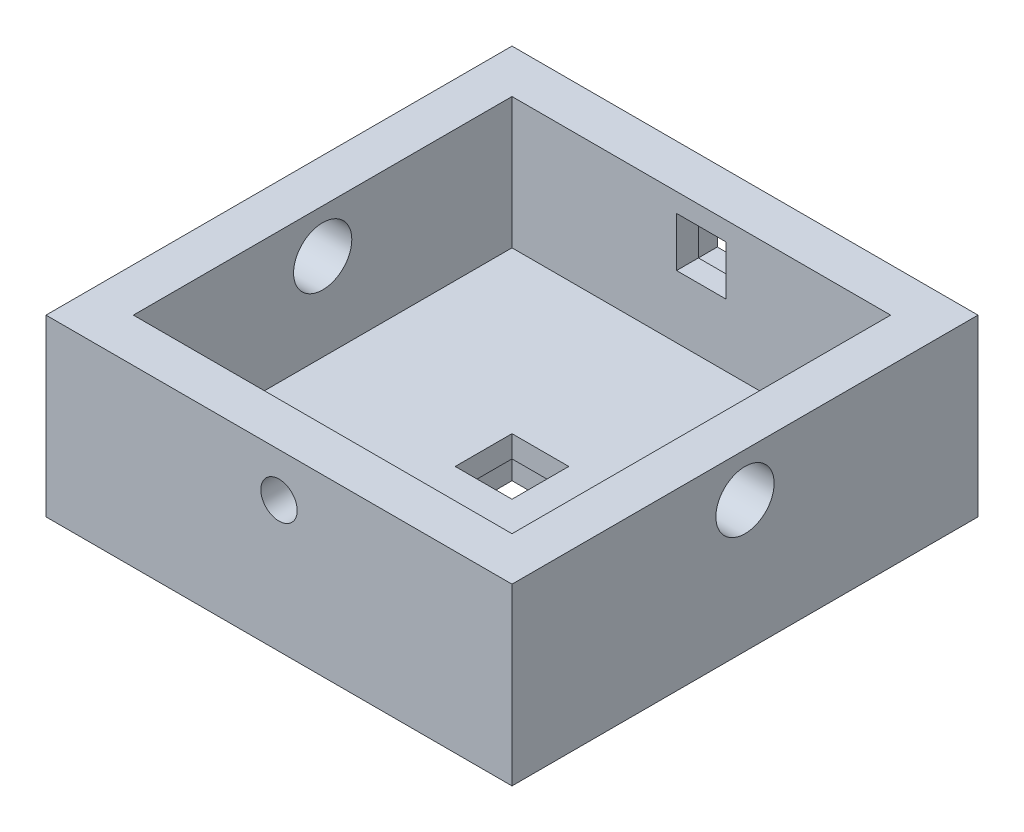
from build123d import *

# Parameters (mm, degrees)
SKETCH12_W          = 26
SKETCH12_H          = 26
BOSS_EXTRUDE7_DEPTH = 3
SKETCH12_6_W        = 32
SKETCH12_6_H        = 32
SKETCH12_6_W_2      = 26
SKETCH12_6_H_2      = 26
BOSS_EXTRUDE8_DEPTH = 12
SKETCH12_7_W        = 3.9
SKETCH12_7_H        = 3.9
CUT_EXTRUDE34_DEPTH = 3
SKETCH12_8_W        = 4.3
SKETCH12_8_H        = 4.3
CUT_EXTRUDE36_DEPTH = 1.5
SKETCH23_R          = 2
CUT_EXTRUDE47_DEPTH = 32
SKETCH24_W          = 3.4
SKETCH24_H          = 3.4
CUT_EXTRUDE48_DEPTH = 3
SKETCH24_3_W        = 3.8
SKETCH24_3_H        = 3.8
CUT_EXTRUDE49_DEPTH = 1.5
SKETCH25_R          = 1.25
CUT_EXTRUDE50_DEPTH = 3


with BuildPart() as part:
    # Sketch12 → Boss-Extrude7 (new body)
    with BuildSketch(Plane(origin=(0, 0, 0), x_dir=(1, 0, 0), z_dir=(0, 1, 0))):
        Rectangle(SKETCH12_W, SKETCH12_H)
    extrude(amount=BOSS_EXTRUDE7_DEPTH)

    # Sketch12<6> → Boss-Extrude8 (add)
    with BuildSketch(Plane(origin=(0, 0, 0), x_dir=(1, 0, 0), z_dir=(0, 1, 0))):
        Rectangle(SKETCH12_6_W, SKETCH12_6_H)
        Rectangle(SKETCH12_6_W_2, SKETCH12_6_H_2, mode=Mode.SUBTRACT)
    extrude(amount=BOSS_EXTRUDE8_DEPTH)

    # Sketch12<7> → Cut-Extrude34 (cut)
    with BuildSketch(Plane(origin=(0, 0, 0), x_dir=(1, 0, 0), z_dir=(0, 1, 0))):
        Rectangle(SKETCH12_7_W, SKETCH12_7_H)
    extrude(amount=CUT_EXTRUDE34_DEPTH, mode=Mode.SUBTRACT)

    # Sketch12<8> → Cut-Extrude36 (cut)
    with BuildSketch(Plane(origin=(0, 0, 0), x_dir=(1, 0, 0), z_dir=(0, 1, 0))):
        Rectangle(SKETCH12_8_W, SKETCH12_8_H)
    extrude(amount=CUT_EXTRUDE36_DEPTH, mode=Mode.SUBTRACT)

    # Sketch23 → Cut-Extrude47 (cut)
    with BuildSketch(Plane(origin=(16, 0, 0), x_dir=(0, 0, -1), z_dir=(1, 0, 0))):
        with Locations((0, 9)):
            Circle(SKETCH23_R)
    extrude(amount=-CUT_EXTRUDE47_DEPTH, mode=Mode.SUBTRACT)

    # Sketch24 → Cut-Extrude48 (cut)
    with BuildSketch(Plane(origin=(0, 0, -16), x_dir=(-1, 0, 0), z_dir=(0, 0, -1))):
        with Locations((0, 9)):
            Rectangle(SKETCH24_W, SKETCH24_H)
    extrude(amount=-CUT_EXTRUDE48_DEPTH, mode=Mode.SUBTRACT)

    # Sketch24<3> → Cut-Extrude49 (cut)
    with BuildSketch(Plane(origin=(0, 0, -16), x_dir=(-1, 0, 0), z_dir=(0, 0, -1))):
        with Locations((0, 9)):
            Rectangle(SKETCH24_3_W, SKETCH24_3_H)
    extrude(amount=-CUT_EXTRUDE49_DEPTH, mode=Mode.SUBTRACT)

    # Sketch25 → Cut-Extrude50 (cut)
    with BuildSketch(Plane.XY.offset(16)):
        with Locations((0, 9)):
            Circle(SKETCH25_R)
    extrude(amount=-CUT_EXTRUDE50_DEPTH, mode=Mode.SUBTRACT)


solid = part.part
